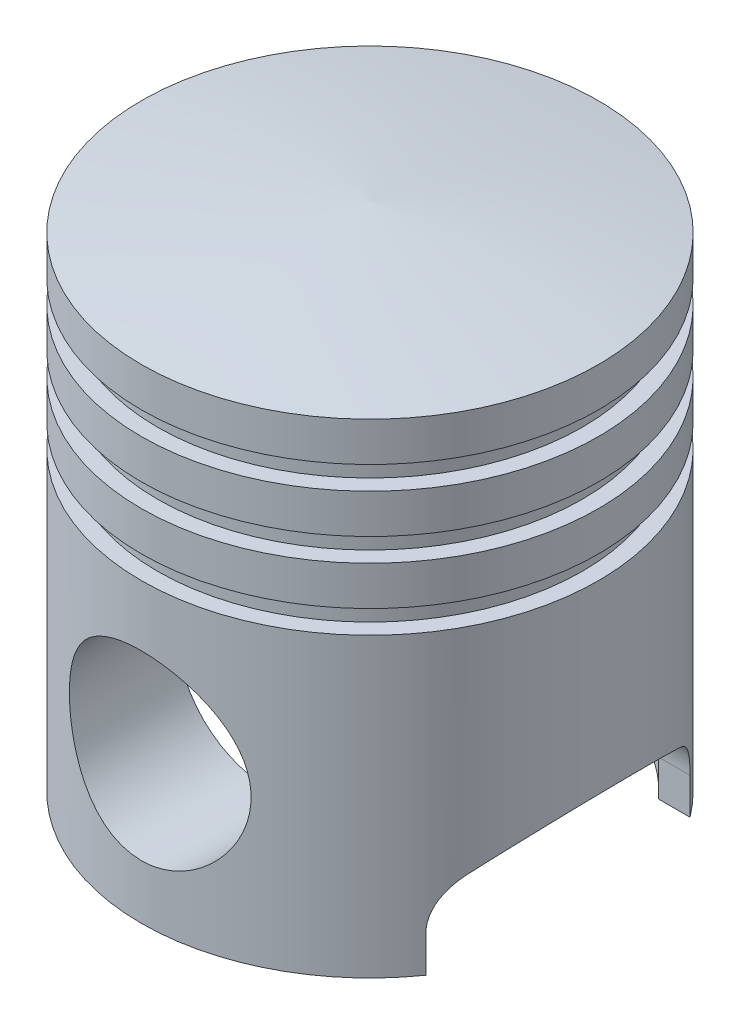
from build123d import *

# Parameters (mm, degrees)
CUT_EXTRUDE2_DEPTH       = 65
CUT_EXTRUDE3_START       = -85.7
SKETCH5_R                = 38
CUT_EXTRUDE3_DEPTH       = 85.7
BOSS_EXTRUDE2_REACH      = 97.608
BOSS_EXTRUDE2_END_RADIUS = 38
BOSS_EXTRUDE2_START      = 19
SKETCH2_R                = 22.5
SKETCH2_R_2              = 16.9
SKETCH2_4_R              = 16.9
CUT_EXTRUDE4_DEPTH       = 65


with BuildPart() as part:
    # Sketch1 → Revolve1 (revolve)
    with BuildSketch(Plane.XY, mode=Mode.PRIVATE) as revolve1_sk:
        with BuildLine():
            Line((42.5, 42.5), (42.5, 35.2))
            Line((42.5, 35.2), (39.5, 35.2))
            Line((39.5, 35.2), (39.5, 30.9))
            Line((39.5, 30.9), (42.5, 30.9))
            Line((42.5, 30.9), (42.5, 23.6))
            Line((42.5, 23.6), (39.5, 23.6))
            Line((39.5, 23.6), (39.5, 19.3))
            Line((39.5, 19.3), (42.5, 19.3))
            Line((42.5, 19.3), (42.5, 12))
            Line((42.5, 12), (39.5, 12))
            Line((39.5, 12), (39.5, 7.7))
            Line((39.5, 7.7), (42.5, 7.7))
            Line((42.5, 7.7), (42.5, -47.5))
            Line((42.5, -47.5), (38, -47.5))
            Line((38, -47.5), (38, -43.5))
            Line((38, -43.5), (19, -43.5))
            Line((19, -43.5), (19, 2))
            Line((19, 2), (38, 2))
            Line((38, 2), (38, 38.2))
            Line((38, 38.2), (0, 38.2))
            Line((0, 38.2), (0, 47.5))
            ThreePointArc((0, 47.5), (21.305973291, 45.475772969), (42.5, 42.5))
        make_face()
    revolve(revolve1_sk.sketch.rotate(Axis((0, 65.639751427, 0), (0, -1, 0)), 90), axis=Axis((0, 65.639751427, 0), (0, -1, 0)))

    # Sketch4 → Cut-Extrude2 (cut, symmetric)
    with BuildSketch(Plane(origin=(0, 0, 0), x_dir=(0, 0, -1), z_dir=(1, 0, 0))):
        with BuildLine():
            Line((-24.398378827, -47.5), (25.601621173, -47.5))
            Line((25.601621173, -47.5), (25.601621173, -40.744227878))
            ThreePointArc((25.601621173, -40.744227878), (24.261875211, -35.744227878), (20.601621173, -32.083973841))
            ThreePointArc((20.601621173, -32.083973841), (0.601621173, -26.724989992), (-19.398378827, -32.083973841))
            ThreePointArc((-19.398378827, -32.083973841), (-23.058632865, -35.744227878), (-24.398378827, -40.744227878))
            Line((-24.398378827, -40.744227878), (-24.398378827, -47.5))
        make_face()
    extrude(amount=CUT_EXTRUDE2_DEPTH, both=True, mode=Mode.SUBTRACT)

    # Sketch5 → Cut-Extrude3 (cut)
    with BuildSketch(Plane.XZ.offset(47.5).offset(CUT_EXTRUDE3_START)):
        with Locations(Location((0, 0, 0), (0, 0, 90))):
            Circle(SKETCH5_R)
    extrude(amount=CUT_EXTRUDE3_DEPTH, mode=Mode.SUBTRACT)

    # Boss-Extrude2: up to this cylinder (the profile starts inside it)
    boss_extrude2_end = Plane(origin=(0, -42.363604, 0), z_dir=(0, 1, 0)) * Cylinder(BOSS_EXTRUDE2_END_RADIUS, 272.216, mode=Mode.PRIVATE)
    # Sketch2 → Boss-Extrude2 (add, up to the surface)
    with BuildSketch(Plane.XY.offset(BOSS_EXTRUDE2_START), mode=Mode.PRIVATE) as boss_extrude2_sk1:
        with Locations(Location((0, -20.5, 0), (0, 0, 90))):
            Circle(SKETCH2_R)
        with Locations(Location((0, -20.5, 0), (0, 0, 180))):
            Circle(SKETCH2_R_2, mode=Mode.SUBTRACT)
    boss_extrude2_tool1 = extrude(boss_extrude2_sk1.sketch, amount=BOSS_EXTRUDE2_REACH, mode=Mode.PRIVATE) & boss_extrude2_end
    boss_extrude2 = boss_extrude2_tool1.solids().sort_by_distance((0, -42.363604, 19))[0]
    add(boss_extrude2)

    # Mirror1: Boss-Extrude2 across plane
    add(boss_extrude2.mirror(Plane.XY))

    # Sketch2<4> → Cut-Extrude4 (cut, symmetric)
    with BuildSketch(Plane.XY):
        with Locations(Location((0, -20.5, 0), (0, 0, 90))):
            Circle(SKETCH2_4_R)
    extrude(amount=CUT_EXTRUDE4_DEPTH, both=True, mode=Mode.SUBTRACT)


solid = part.part
